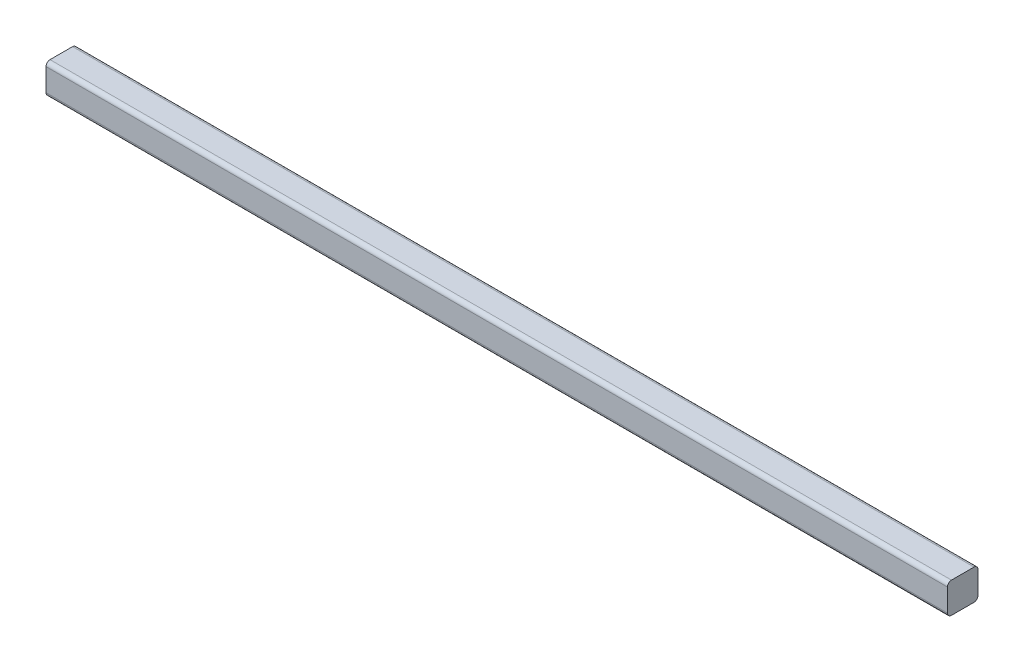
from build123d import *

# Parameters (mm, degrees)
SKETCH1_W           = 38.1
SKETCH1_H           = 38.1
BOSS_EXTRUDE1_DEPTH = 561.975
FILLET1_R           = 5


with BuildPart() as part:
    # Sketch1 → Boss-Extrude1 (new, symmetric)
    with BuildSketch(Plane(origin=(0, 0, 0), x_dir=(0, 0, -1), z_dir=(1, 0, 0))):
        Rectangle(SKETCH1_W, SKETCH1_H)
    extrude(amount=BOSS_EXTRUDE1_DEPTH, both=True)

    # Fillet1
    fillet1_edges = [part.edges().sort_by_distance(p)[0] for p in [
        (0, -19.05, -19.05),
        (0, -19.05, 19.05),
        (0, 19.05, 19.05),
        (0, 19.05, -19.05),
    ]]
    fillet(fillet1_edges, radius=FILLET1_R)


solid = part.part
